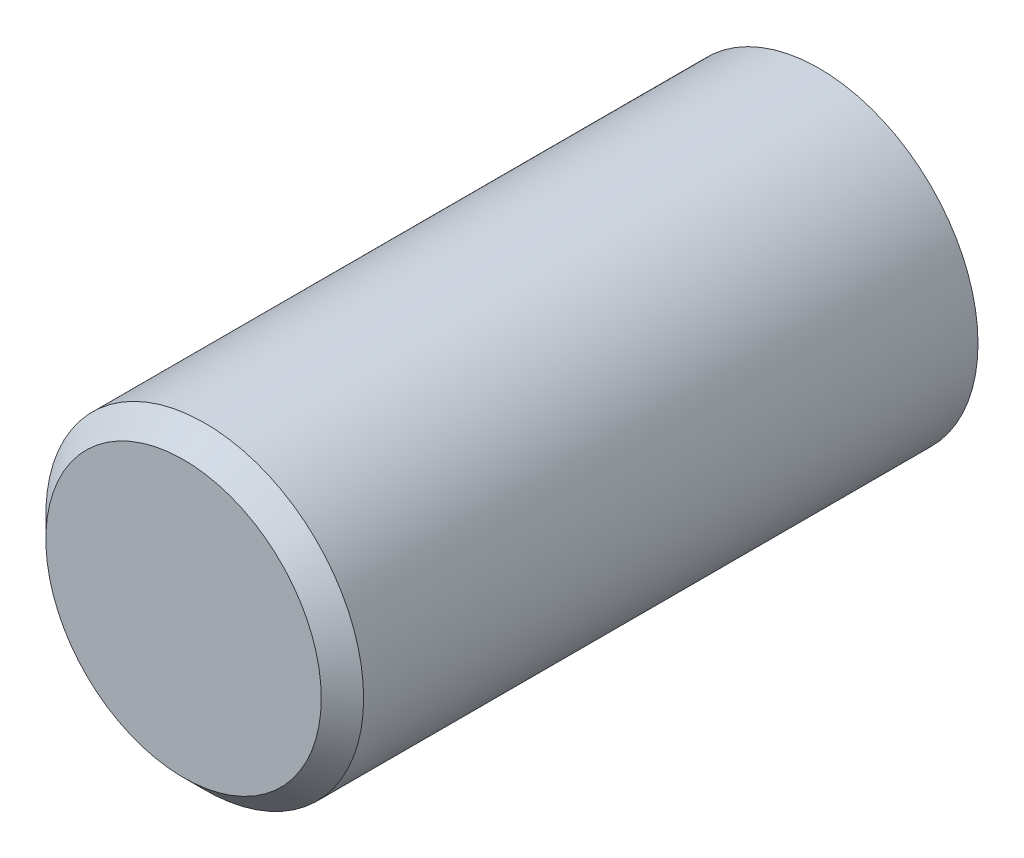
from build123d import *

# Parameters (mm, degrees)
SKETCH1_R           = 1.5
BOSS_EXTRUDE1_DEPTH = 6
CHAMFER1_SIZE       = 0.2


with BuildPart() as part:
    # Sketch1 → Boss-Extrude1 (new body)
    with BuildSketch(Plane.XY):
        Circle(SKETCH1_R)
    extrude(amount=BOSS_EXTRUDE1_DEPTH)

    # Chamfer1
    chamfer1_edges = [part.edges().sort_by_distance(p)[0] for p in [
        (-1.5, 0, 6),
    ]]
    chamfer(chamfer1_edges, length=CHAMFER1_SIZE)


solid = part.part
